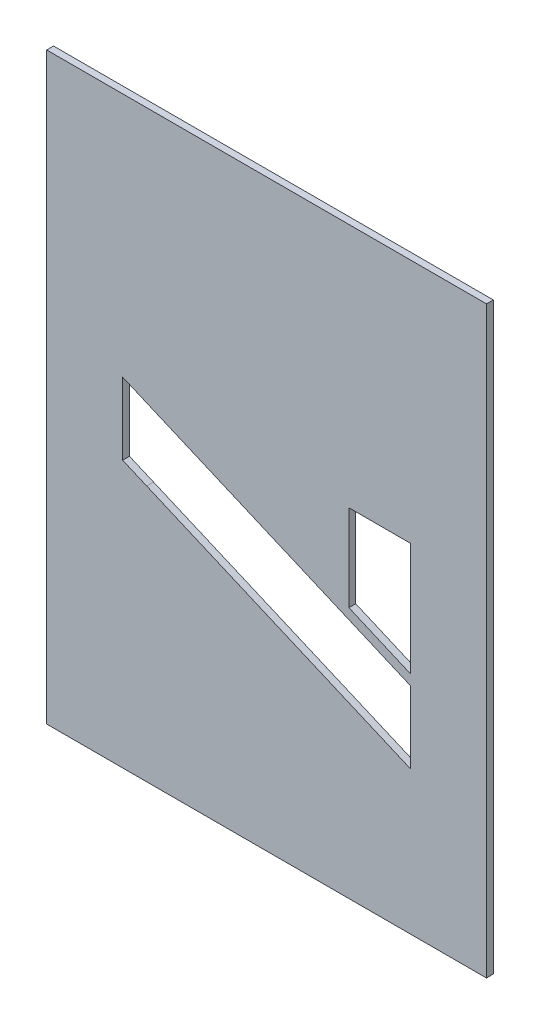
from build123d import *

# Parameters (mm, degrees)
SKETCH_1_W                     = 305.5
SKETCH_1_H                     = 1221.15
EXTRUDE_1_DEPTH                = 4.75
CUT_EXTRUDE_2_DEPTH            = 4.75
SPLIT_BODIES_1_SURFACE_1_BACK  = 1259.793
SPLIT_BODIES_1_SURFACE_1_DEPTH = 2519.586


with BuildPart() as part:
    # 草圖1 → 填料-伸長1 (new body)
    with BuildSketch(Plane.XY):
        Rectangle(SKETCH_1_W, SKETCH_1_H)
    extrude(amount=EXTRUDE_1_DEPTH)

    # 草圖2 → 除料-伸長2 (cut)
    with BuildSketch(Plane.XY.offset(4.75)):
        Polygon((100.025, 354.412698413), (100.025, 304.423280423), (-83.25542328, 382.984126984), (-99.975, 390.137566138), (-99.975, 440.126984127), (83.30542328, 361.566137566), align=None)
        Polygon((57.189021164, 380.021164021), (57.189021164, 440.126984127), (100.025, 440.126984127), (100.025, 361.566137566), align=None)
        Polygon((50.035582011, 106.53968254), (57.189021164, 106.53968254), (57.189021164, 120.846560847), (100.025, 120.846560847), (100.025, 84.994708995), (71.453571429, 56.55026455), (50.035582011, 56.55026455), align=None)
        Polygon((-71.403571429, 56.55026455), (-99.975, 84.994708995), (-99.975, 120.846560847), (-57.096693122, 120.846560847), (-57.096693122, 106.53968254), (-21.414153439, 106.53968254), (-21.414153439, 120.846560847), (21.464153439, 120.846560847), (21.464153439, 85.121693122), (-7.107275132, 56.55026455), align=None)
        Polygon((-21.414153439, 142.264550265), (-57.096693122, 142.264550265), (-57.096693122, 127.830687831), (-99.975, 128), (-99.975, 163.682539683), (-71.403571429, 192.423280423), (71.453571429, 192.253968254), (100.025, 163.682539683), (100.025, 127.830687831), (57.189021164, 127.830687831), (57.189021164, 142.264550265), (21.464153439, 142.264550265), (21.464153439, 128), (-21.414153439, 128), align=None)
        Polygon((21.591137566, -141.164021164), (57.189021164, -141.164021164), (57.189021164, -127.026455026), (100.025, -127.026455026), (100.025, -162.878306878), (71.453571429, -191.322751323), (7.157275132, -191.322751323), (0.046164021, -184.042328042), (-6.980291005, -191.44973545), (-71.276587302, -191.44973545), (-99.848015873, -163.047619048), (-99.975, -127.026455026), (-57.096693122, -127.026455026), (-56.969708995, -141.333333333), (-21.24484127, -141.333333333), (-21.414153439, -127.026455026), (21.29484127, -126.899470899), (21.29484127, -127.153439153), (21.591137566, -127.153439153), align=None)
        Polygon((50.035582011, -55.44973545), (71.453571429, -55.44973545), (100.025, -84.19047619), (100.025, -120.042328042), (57.189021164, -120.042328042), (57.189021164, -105.608465608), (50.035582011, -105.608465608), align=None)
        Polygon((-49.985582011, -105.608465608), (-57.096693122, -105.608465608), (-57.096693122, -120.042328042), (-99.975, -119.873015873), (-99.975, -84.19047619), (-71.403571429, -55.44973545), (-49.985582011, -55.44973545), align=None)
        Polygon((50.035582011, -389.206349206), (57.189021164, -389.206349206), (57.189021164, -374.899470899), (100.025, -374.899470899), (100.025, -410.751322751), (71.453571429, -439.195767196), (50.035582011, -439.195767196), align=None)
        Polygon((-71.403571429, -439.195767196), (-99.975, -410.751322751), (-99.975, -374.899470899), (-57.096693122, -374.899470899), (-57.096693122, -389.206349206), (-21.414153439, -389.206349206), (-21.414153439, -374.899470899), (21.464153439, -374.899470899), (21.464153439, -410.624338624), (-7.107275132, -439.195767196), align=None)
        Polygon((-21.414153439, -353.481481481), (-57.096693122, -353.481481481), (-57.096693122, -367.915343915), (-99.975, -367.746031746), (-99.975, -332.063492063), (-71.403571429, -303.322751323), (71.453571429, -303.492063492), (100.025, -332.063492063), (100.025, -367.915343915), (57.189021164, -367.915343915), (57.189021164, -353.481481481), (21.464153439, -353.481481481), (21.464153439, -367.746031746), (-21.414153439, -367.746031746), align=None)
    extrude(amount=-CUT_EXTRUDE_2_DEPTH, mode=Mode.SUBTRACT)

    # Split Bodies 1: cut with a surface, the side it looks to stays
    # Split Bodies 1 surface: a surface, the sketch's curves swept straight by 2519.586 mm
    with BuildLine(Plane.XY.offset(4.75).offset(-SPLIT_BODIES_1_SURFACE_1_BACK), mode=Mode.PRIVATE) as split_bodies_1_surface_1_path:
        Line((-152.75, 205.025), (152.75, 205.025))
    split_bodies_1_surface_1 = Shell.extrude(split_bodies_1_surface_1_path.wire(), (0 * SPLIT_BODIES_1_SURFACE_1_DEPTH, 0 * SPLIT_BODIES_1_SURFACE_1_DEPTH, 1 * SPLIT_BODIES_1_SURFACE_1_DEPTH))
    split(bisect_by=split_bodies_1_surface_1, keep=Keep.TOP)


solid = part.part
